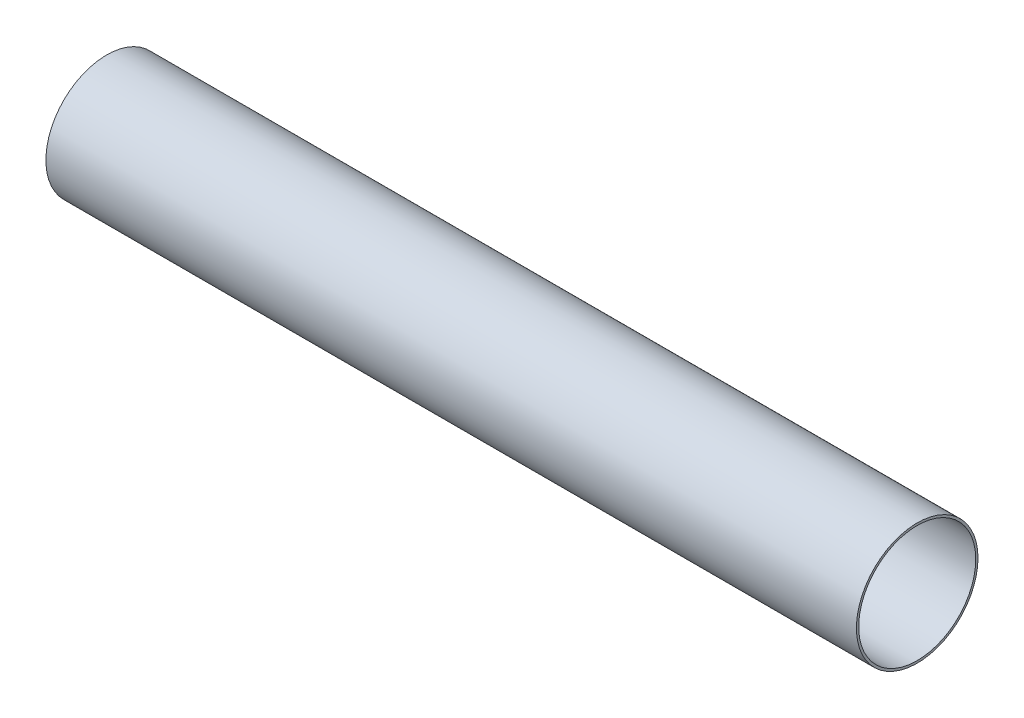
from build123d import *

# Parameters (mm, degrees)
SKETCH3_R           = 19.05
SKETCH3_R_2         = 18.3388
BOSS_EXTRUDE1_DEPTH = 127


with BuildPart() as part:
    # Sketch3 → Boss-Extrude1 (new, symmetric)
    with BuildSketch(Plane(origin=(0, 0, 0), x_dir=(0, 0, -1), z_dir=(1, 0, 0))):
        Circle(SKETCH3_R)
        Circle(SKETCH3_R_2, mode=Mode.SUBTRACT)
    extrude(amount=BOSS_EXTRUDE1_DEPTH, both=True)


solid = part.part
